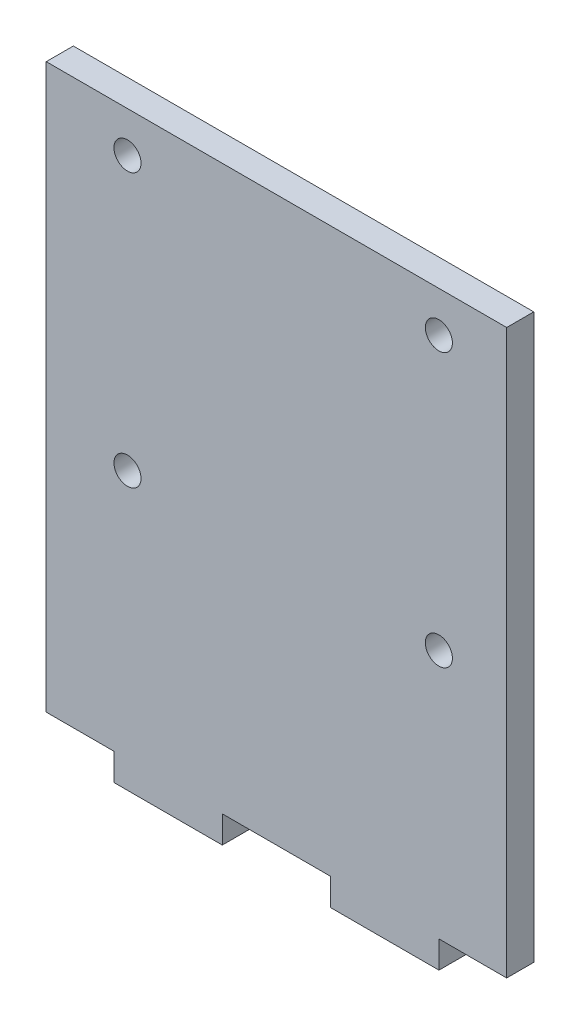
from build123d import *

# Parameters (mm, degrees)
SKETCH1_R           = 1.5875
BOSS_EXTRUDE1_DEPTH = 3.175


with BuildPart() as part:
    # Sketch1 → Boss-Extrude1 (new body)
    with BuildSketch(Plane.XY):
        Polygon((53.975, 66.04), (9.525, 66.04), (0, 66.04), (0, 0), (7.9375, 0), (7.9375, -3.175), (20.6375, -3.175), (20.6375, 0), (33.3375, 0), (33.3375, -3.175), (46.0375, -3.175), (46.0375, 0), (53.975, 0), align=None)
        with BuildLine():
            ThreePointArc((9.525, 27.69), (7.9375, 29.2775), (9.525, 30.865))
            ThreePointArc((9.525, 30.865), (10.647532015, 30.400032015), (11.1125, 29.2775))
            ThreePointArc((11.1125, 29.2775), (10.647532015, 28.154967985), (9.525, 27.69))
        make_face(mode=Mode.SUBTRACT)
        with Locations((46.025, 29.2775)):
            Circle(SKETCH1_R, mode=Mode.SUBTRACT)
        with BuildLine():
            ThreePointArc((9.525, 59.69), (7.9375, 61.2775), (9.525, 62.865))
            ThreePointArc((9.525, 62.865), (10.647532015, 62.400032015), (11.1125, 61.2775))
            ThreePointArc((11.1125, 61.2775), (10.647532015, 60.154967985), (9.525, 59.69))
        make_face(mode=Mode.SUBTRACT)
        with Locations((46.025, 61.2775)):
            Circle(SKETCH1_R, mode=Mode.SUBTRACT)
    extrude(amount=BOSS_EXTRUDE1_DEPTH)


solid = part.part
